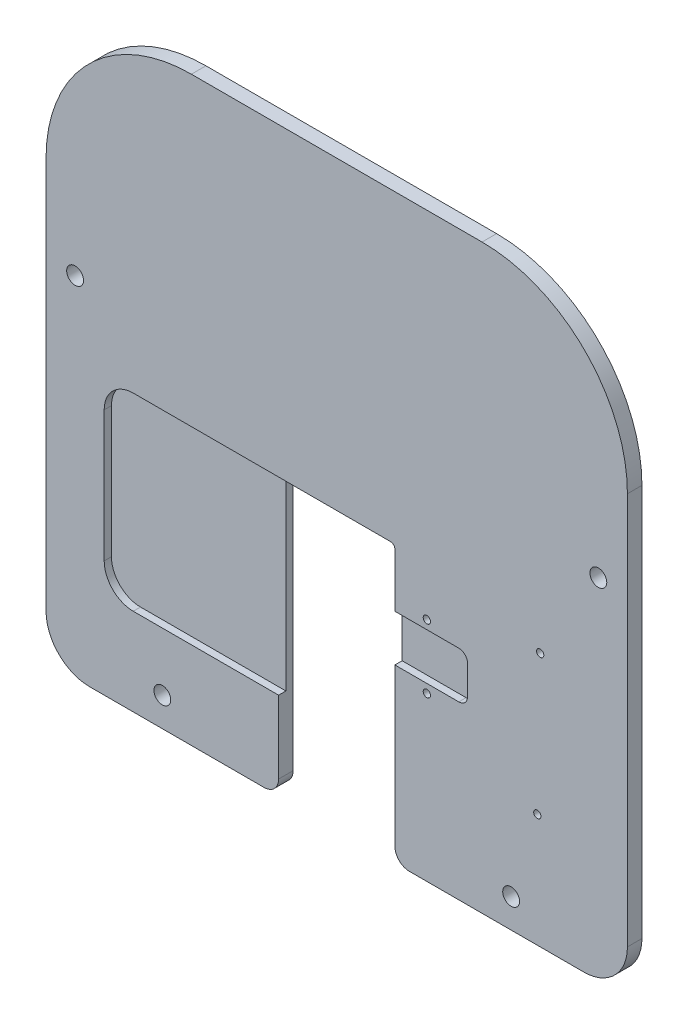
from build123d import *

# Parameters (mm, degrees)
SKETCH_1_W             = 200
SKETCH_1_H             = 200
EXTRUDE_1_DEPTH        = 5
SKETCH_2_W             = 40
SKETCH_2_H             = 95
CUT_EXTRUDE_1_DEPTH    = 149.744747806
FILLET_1_R             = 50
FILLET_2_R             = 1.5
M3X0_5_1_D             = 2.5
M3X0_5_1_DEPTH         = 5
M3X0_5_1_TIP           = 0.751075774
FILLET_3_R             = 15
FILLET_4_R             = 5
HOLE_WIZARD_M5_1_D     = 5.8
HOLE_WIZARD_M5_1_DEPTH = 5
HOLE_WIZARD_M5_1_TIP   = 1.742495795
SKETCH_10_W            = 60
SKETCH_10_H            = 65
CUT_EXTRUDE_2_DEPTH    = 2.5
FILLET_5_R             = 10
SKETCH_11_W            = 25
SKETCH_11_H            = 16
CUT_EXTRUDE_3_DEPTH    = 2.5
FILLET_6_R             = 3


with BuildPart() as part:
    # ｽｹｯﾁ1 → ﾎﾞｽ - 押し出し1 (new body)
    with BuildSketch(Plane.XY):
        with Locations((0, 10)):
            Rectangle(SKETCH_1_W, SKETCH_1_H)
    extrude(amount=EXTRUDE_1_DEPTH)

    # ｽｹｯﾁ2 → ｶｯﾄ - 押し出し1 (cut, through all)
    with BuildSketch(Plane.XY.offset(5)):
        with Locations((0, -42.5)):
            Rectangle(SKETCH_2_W, SKETCH_2_H)
    extrude(amount=-CUT_EXTRUDE_1_DEPTH, mode=Mode.SUBTRACT)

    # ﾌｨﾚｯﾄ1
    fillet_1_edges = [part.edges().sort_by_distance(p)[0] for p in [
        (-100, 110, 2.5),
        (100, 110, 2.5),
    ]]
    fillet(fillet_1_edges, radius=FILLET_1_R)

    # ﾌｨﾚｯﾄ2
    fillet_2_edges = [part.edges().sort_by_distance(p)[0] for p in [
        (20, 5, 2.5),
    ]]
    fillet(fillet_2_edges, radius=FILLET_2_R)

    # M3x0.5 ねじ穴用ねじ下穴ﾄﾞﾘﾙ1
    with Locations(Plane.XY.offset(5)):
        with Locations((70, -2.5), (31, -12), (31, -34), (69, -51)):
            Hole(M3X0_5_1_D / 2, depth=M3X0_5_1_DEPTH)
            with Locations((0, 0, -(M3X0_5_1_DEPTH + M3X0_5_1_TIP / 2))):  # 118° drill point
                Cone(0, M3X0_5_1_D / 2, M3X0_5_1_TIP, mode=Mode.SUBTRACT)

    # ﾌｨﾚｯﾄ3
    fillet_3_edges = [part.edges().sort_by_distance(p)[0] for p in [
        (100, -90, 2.5),
        (-100, -90, 2.5),
    ]]
    fillet(fillet_3_edges, radius=FILLET_3_R)

    # ﾌｨﾚｯﾄ4
    fillet_4_edges = [part.edges().sort_by_distance(p)[0] for p in [
        (-20, -90, 2.5),
        (20, -90, 2.5),
    ]]
    fillet(fillet_4_edges, radius=FILLET_4_R)

    # M5 すきま穴1
    with Locations(Plane(origin=(0, 0, 0), x_dir=(-1, 0, 0), z_dir=(0, 0, -1))):
        with Locations((-60, -80), (60, -80), (-90, 30), (90, 30)):
            Hole(HOLE_WIZARD_M5_1_D / 2, depth=HOLE_WIZARD_M5_1_DEPTH)
            with Locations((0, 0, -(HOLE_WIZARD_M5_1_DEPTH + HOLE_WIZARD_M5_1_TIP / 2))):  # 118° drill point
                Cone(0, HOLE_WIZARD_M5_1_D / 2, HOLE_WIZARD_M5_1_TIP, mode=Mode.SUBTRACT)

    # ｽｹｯﾁ10 → ｶｯﾄ - 押し出し2 (cut)
    with BuildSketch(Plane.XY.offset(5)):
        with Locations((-50, -27.5)):
            Rectangle(SKETCH_10_W, SKETCH_10_H)
    extrude(amount=-CUT_EXTRUDE_2_DEPTH, mode=Mode.SUBTRACT)

    # ﾌｨﾚｯﾄ5
    fillet_5_edges = [part.edges().sort_by_distance(p)[0] for p in [
        (-80, -60, 3.75),
        (-80, 5, 3.75),
    ]]
    fillet(fillet_5_edges, radius=FILLET_5_R)

    # ｽｹｯﾁ11 → ｶｯﾄ - 押し出し3 (cut)
    with BuildSketch(Plane.XY.offset(5)):
        with Locations((32.5, -23)):
            Rectangle(SKETCH_11_W, SKETCH_11_H)
    extrude(amount=-CUT_EXTRUDE_3_DEPTH, mode=Mode.SUBTRACT)

    # ﾌｨﾚｯﾄ6
    fillet_6_edges = [part.edges().sort_by_distance(p)[0] for p in [
        (45, -15, 3.75),
        (45, -31, 3.75),
    ]]
    fillet(fillet_6_edges, radius=FILLET_6_R)


solid = part.part
